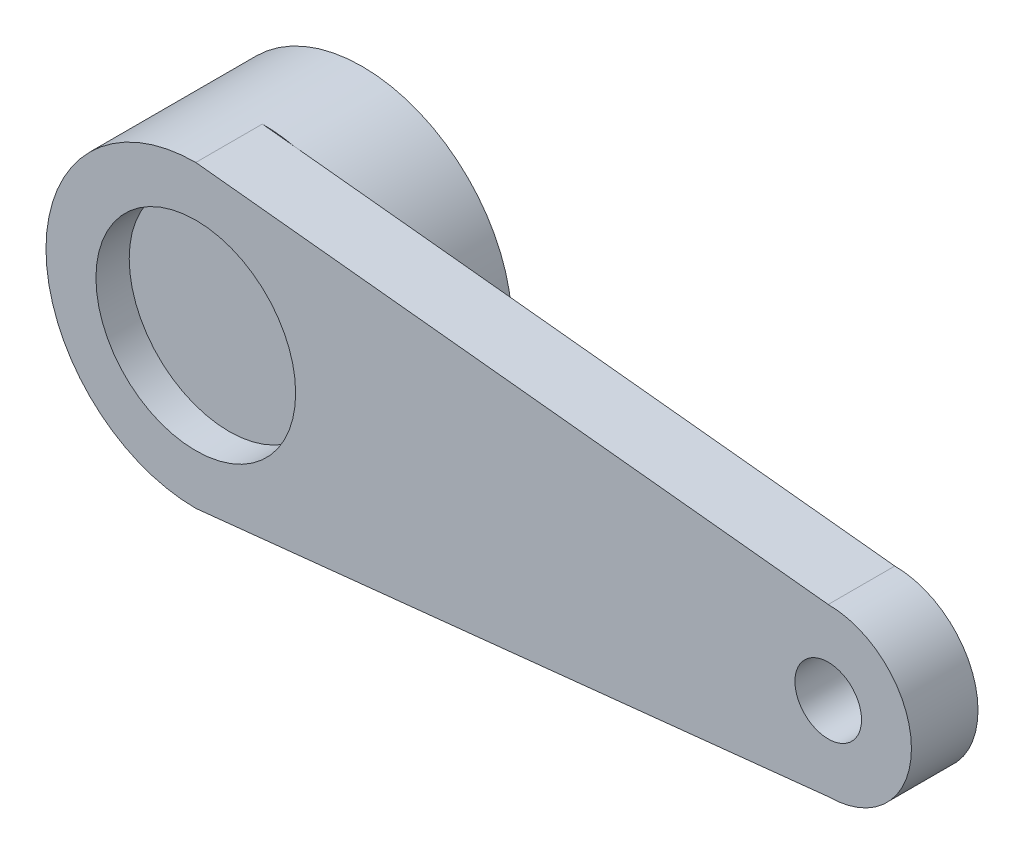
from build123d import *

# Parameters (mm, degrees)
BOSS_EXTRUDE1_DEPTH = 2
SKETCH3_R           = 1
CUT_EXTRUDE1_DEPTH  = 3
BOSS_EXTRUDE3_START = 3
SKETCH4_R           = 4.5
BOSS_EXTRUDE3_DEPTH = 3
SKETCH5_R           = 3
CUT_EXTRUDE2_DEPTH  = 1


with BuildPart() as part:
    # Sketch1 → Boss-Extrude1 (new body)
    with BuildSketch(Plane.XY):
        with BuildLine():
            Line((6.441226576, 5.332197615), (-12.558773424, 7.332197615))
            ThreePointArc((-12.558773424, 7.332197615), (-17.058773424, 2.832197615), (-12.558773424, -1.667802385))
            Line((-12.558773424, -1.667802385), (6.441226576, 0.332197615))
            ThreePointArc((6.441226576, 0.332197615), (8.941226576, 2.832197615), (6.441226576, 5.332197615))
        make_face()
    extrude(amount=BOSS_EXTRUDE1_DEPTH)

    # Sketch3 → Cut-Extrude1 (cut)
    with BuildSketch(Plane.XY.offset(2)):
        with Locations((6.441226576, 2.832197615)):
            Circle(SKETCH3_R)
    extrude(amount=-CUT_EXTRUDE1_DEPTH, mode=Mode.SUBTRACT)

    # Sketch4 → Boss-Extrude3 (add)
    with BuildSketch(Plane(origin=(0, 0, 0), x_dir=(-1, 0, 0), z_dir=(0, 0, -1)).offset(BOSS_EXTRUDE3_START)):
        with Locations((12.558773424, 2.832197615)):
            Circle(SKETCH4_R)
    extrude(amount=-BOSS_EXTRUDE3_DEPTH)

    # Sketch5 → Cut-Extrude2 (cut)
    with BuildSketch(Plane.XY.offset(2)):
        with Locations((-12.558773424, 2.832197615)):
            Circle(SKETCH5_R)
    extrude(amount=-CUT_EXTRUDE2_DEPTH, mode=Mode.SUBTRACT)


solid = part.part
